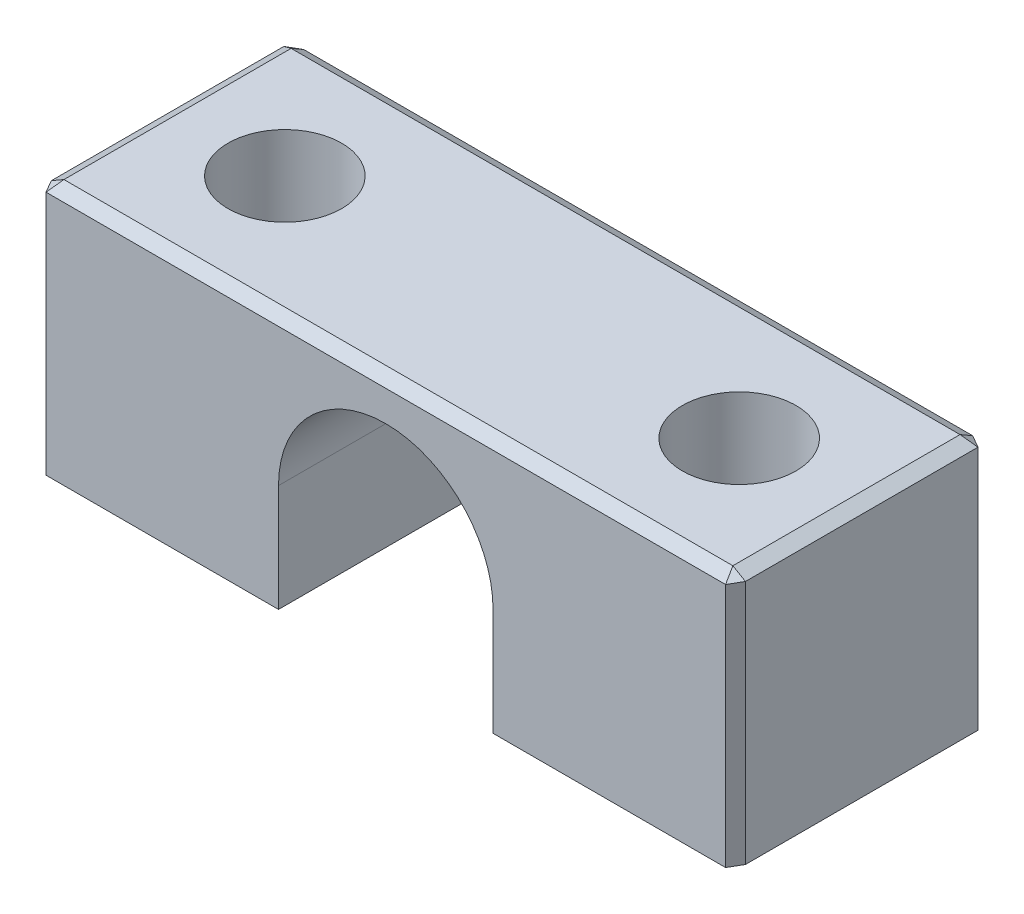
from build123d import *
from OCP.BRepFilletAPI import BRepFilletAPI_MakeChamfer

# Parameters (mm, degrees)
ESTRUSIONE_ESTRUSIONE1_DEPTH = 20
SCHIZZO2_R                   = 4.5
TAGLIO_ESTRUSIONE1_DEPTH     = 40.449334595
SMUSSO1_SIZE                 = 1
SMUSSO1_SIZE2                = 0.577350269


with BuildPart() as part:
    # Schizzo1 → Estrusione-Estrusione1 (new body)
    with BuildSketch(Plane.XY):
        with BuildLine():
            Line((-8.5, 8.5), (-8.5, 0))
            Line((-8.5, 0), (-27.5, 0))
            Line((-27.5, 0), (-27.5, 20))
            Line((-27.5, 20), (27.5, 20))
            Line((27.5, 20), (27.5, 0))
            Line((27.5, 0), (8.5, 0))
            Line((8.5, 0), (8.5, 8.5))
            ThreePointArc((8.5, 8.5), (0, 17), (-8.5, 8.5))
        make_face()
    extrude(amount=ESTRUSIONE_ESTRUSIONE1_DEPTH)

    # Schizzo2 → Taglio-Estrusione1 (cut, through all)
    with BuildSketch(Plane.XZ):
        with Locations((-18, 10)):
            Circle(SCHIZZO2_R)
        with Locations((18, 10)):
            Circle(SCHIZZO2_R)
    extrude(amount=-TAGLIO_ESTRUSIONE1_DEPTH, mode=Mode.SUBTRACT)

    # Smusso1: one chamfer whose edges measure the first distance from different faces: ONE call of the kernel's chamfer builder (chamfer() names one face for all edges)
    smusso1_edges_1 = [part.edges().sort_by_distance(p)[0] for p in [
        (-27.5, 10, 20),
    ]]
    smusso1_side_1 = [part.faces().sort_by_distance(p)[0] for p in [
        (-27.5, 10, 10),
    ]]
    smusso1_edges_2 = [part.edges().sort_by_distance(p)[0] for p in [
        (0, 20, 0),
        (-27.5, 20, 10),
        (27.5, 20, 10),
        (0, 20, 20),
    ]]
    smusso1_side_2 = [part.faces().sort_by_distance(p)[0] for p in [
        (0, 20, 10),
    ]]
    smusso1_edges_3 = [part.edges().sort_by_distance(p)[0] for p in [
        (27.5, 10, 0),
        (-27.5, 10, 0),
    ]]
    smusso1_side_3 = [part.faces().sort_by_distance(p)[0] for p in [
        (-9.085234996, 4.25, 0),
    ]]
    smusso1_edges_4 = [part.edges().sort_by_distance(p)[0] for p in [
        (27.5, 10, 20),
    ]]
    smusso1_side_4 = [part.faces().sort_by_distance(p)[0] for p in [
        (27.5, 10, 10),
    ]]
    smusso1 = BRepFilletAPI_MakeChamfer(part.part.solid().wrapped)
    for e in smusso1_edges_1:
        smusso1.Add(SMUSSO1_SIZE, SMUSSO1_SIZE2, e.wrapped, smusso1_side_1[0].wrapped)  # the first distance lies on this face
    for e in smusso1_edges_2:
        smusso1.Add(SMUSSO1_SIZE, SMUSSO1_SIZE2, e.wrapped, smusso1_side_2[0].wrapped)  # the first distance lies on this face
    for e in smusso1_edges_3:
        smusso1.Add(SMUSSO1_SIZE, SMUSSO1_SIZE2, e.wrapped, smusso1_side_3[0].wrapped)  # the first distance lies on this face
    for e in smusso1_edges_4:
        smusso1.Add(SMUSSO1_SIZE, SMUSSO1_SIZE2, e.wrapped, smusso1_side_4[0].wrapped)  # the first distance lies on this face
    add(Compound.cast(smusso1.Shape()), mode=Mode.REPLACE)


solid = part.part
